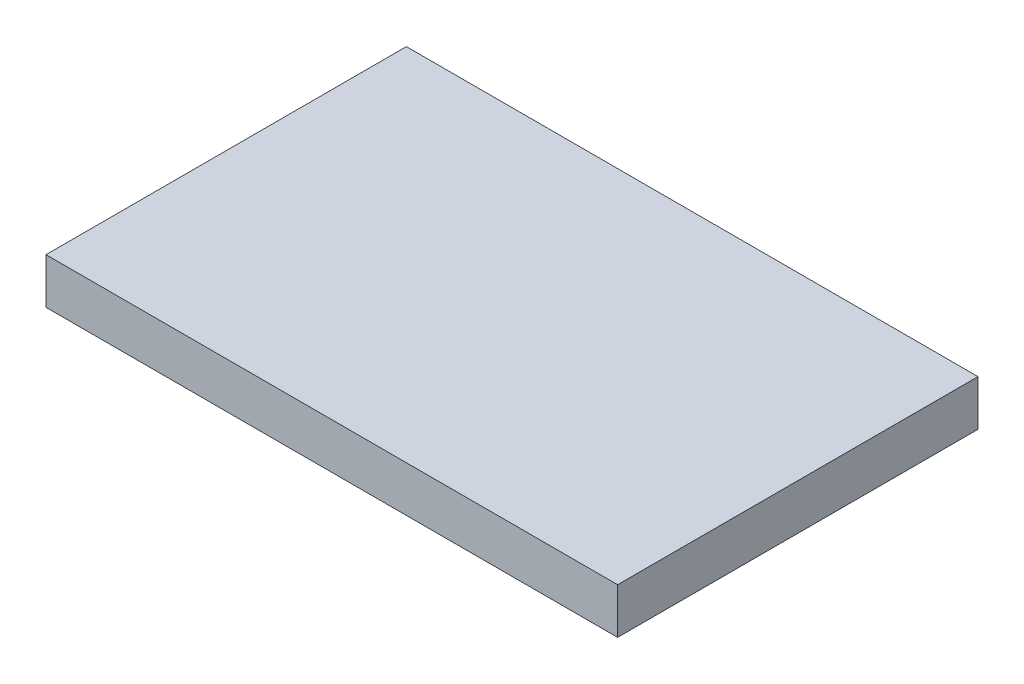
from build123d import *

# Parameters (mm, degrees)
ESQUISSE1_W        = 12.15
ESQUISSE1_H        = 7.66
BOSS_EXTRU_1_DEPTH = 0.97


with BuildPart() as part:
    # Esquisse1 → Boss.-Extru.1 (new body)
    with BuildSketch(Plane(origin=(0, 0, 0), x_dir=(1, 0, 0), z_dir=(0, 1, 0))):
        Rectangle(ESQUISSE1_W, ESQUISSE1_H)
    extrude(amount=BOSS_EXTRU_1_DEPTH)


solid = part.part
